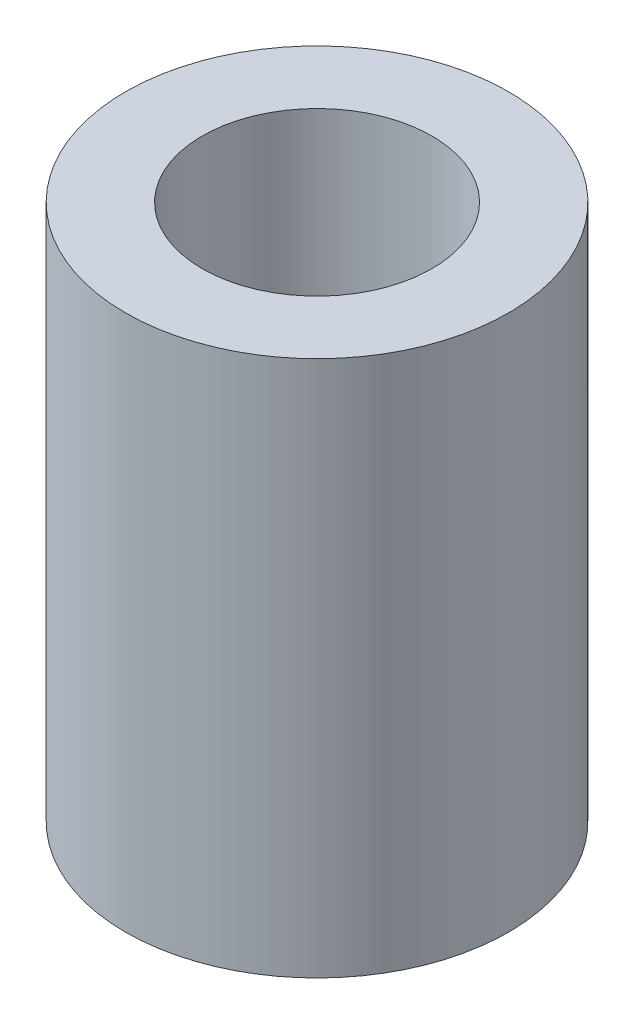
from build123d import *

# Parameters (mm, degrees)
SKETCH2_R           = 2.5
SKETCH2_R_2         = 1.5
BOSS_EXTRUDE1_DEPTH = 7


with BuildPart() as part:
    # Sketch2 → Boss-Extrude1 (new body)
    with BuildSketch(Plane(origin=(0, 0, 0), x_dir=(1, 0, 0), z_dir=(0, 1, 0))):
        with Locations(Location((0, 0, 0), (0, 0, 270))):
            Circle(SKETCH2_R)
        with Locations(Location((0, 0, 0), (0, 0, 270))):
            Circle(SKETCH2_R_2, mode=Mode.SUBTRACT)
    extrude(amount=BOSS_EXTRUDE1_DEPTH)


solid = part.part
